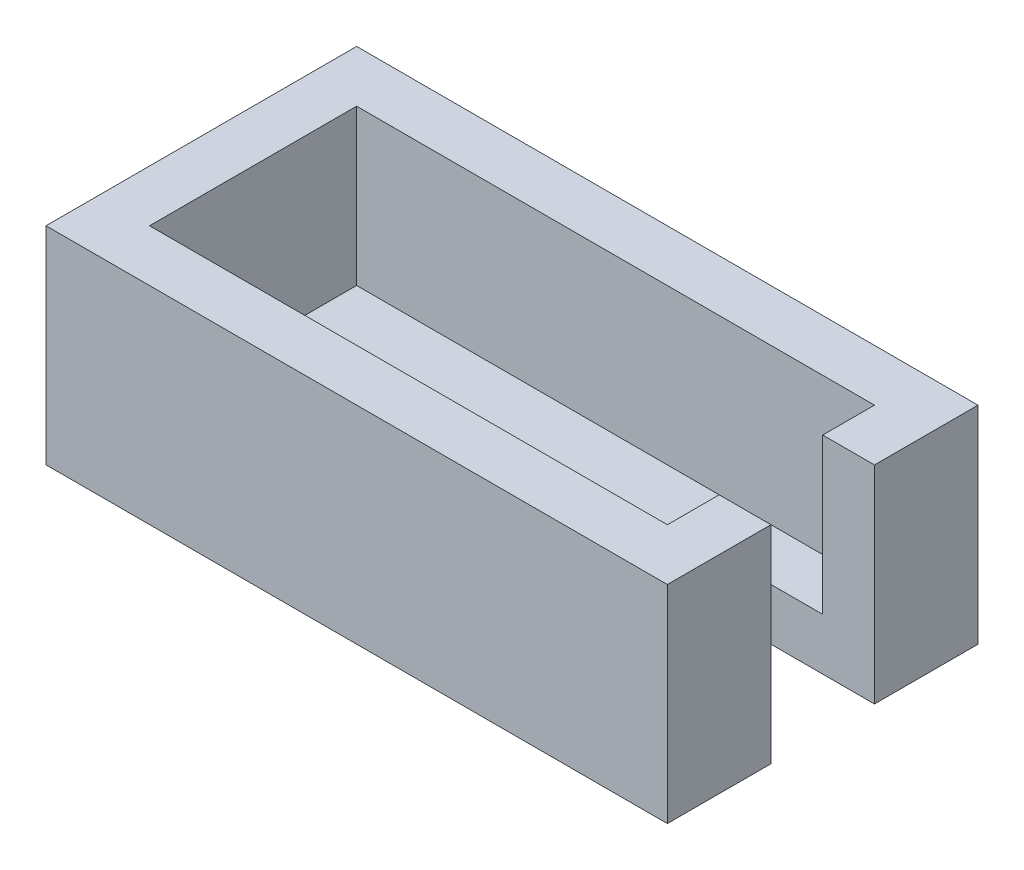
from build123d import *

# Parameters (mm, degrees)
SKETCH3_W           = 304.898736347
SKETCH3_H           = 152.426093062
BOSS_EXTRUDE1_DEPTH = 101.6
SKETCH4_W           = 63.5
SKETCH4_H           = 50.8
CUT_EXTRUDE1_DEPTH  = 147.32
SKETCH5_W           = 254.098736347
SKETCH5_H           = 101.626093062
SKETCH5_R           = 19.05
CUT_EXTRUDE2_DEPTH  = 76.2
CUT_EXTRUDE3_START  = 138.938
SKETCH7_R           = 19.05
CUT_EXTRUDE3_DEPTH  = 138.938


with BuildPart() as part:
    # Sketch3 → Boss-Extrude1 (new body)
    with BuildSketch(Plane(origin=(0, 0, 0), x_dir=(1, 0, 0), z_dir=(0, 1, 0))):
        with Locations((152.449368174, 76.213046531)):
            Rectangle(SKETCH3_W, SKETCH3_H)
    extrude(amount=BOSS_EXTRUDE1_DEPTH)

    # Sketch4 → Cut-Extrude1 (cut)
    with BuildSketch(Plane(origin=(0, 0, 0), x_dir=(1, 0, 0), z_dir=(0, 1, 0))):
        with Locations((273.148736347, 76.226093062)):
            Rectangle(SKETCH4_W, SKETCH4_H)
    extrude(amount=CUT_EXTRUDE1_DEPTH, mode=Mode.SUBTRACT)

    # Sketch5 → Cut-Extrude2 (cut)
    with BuildSketch(Plane(origin=(0, 101.6, 0), x_dir=(1, 0, 0), z_dir=(0, 1, 0))):
        with Locations((152.449368174, 76.213046531)):
            Rectangle(SKETCH5_W, SKETCH5_H)
        with Locations(Location((76.2, 76.226093062, 0), (0, 0, 270))):
            Circle(SKETCH5_R, mode=Mode.SUBTRACT)
        with Locations(Location((133.35, 76.226093062, 0), (0, 0, 270))):
            Circle(SKETCH5_R, mode=Mode.SUBTRACT)
        with Locations(Location((190.5, 76.226093062, 0), (0, 0, 270))):
            Circle(SKETCH5_R, mode=Mode.SUBTRACT)
    extrude(amount=-CUT_EXTRUDE2_DEPTH, mode=Mode.SUBTRACT)

    # Sketch7 → Cut-Extrude3 (cut)
    with BuildSketch(Plane(origin=(0, 0, 0), x_dir=(1, 0, 0), z_dir=(0, 1, 0)).offset(CUT_EXTRUDE3_START)):
        with Locations(Location((76.2, 76.226093062, 0), (0, 0, 270))):
            Circle(SKETCH7_R)
        with Locations(Location((133.35, 76.226093062, 0), (0, 0, 270))):
            Circle(SKETCH7_R)
        with Locations(Location((190.5, 76.226093062, 0), (0, 0, 270))):
            Circle(SKETCH7_R)
    extrude(amount=-CUT_EXTRUDE3_DEPTH, mode=Mode.SUBTRACT)


solid = part.part
